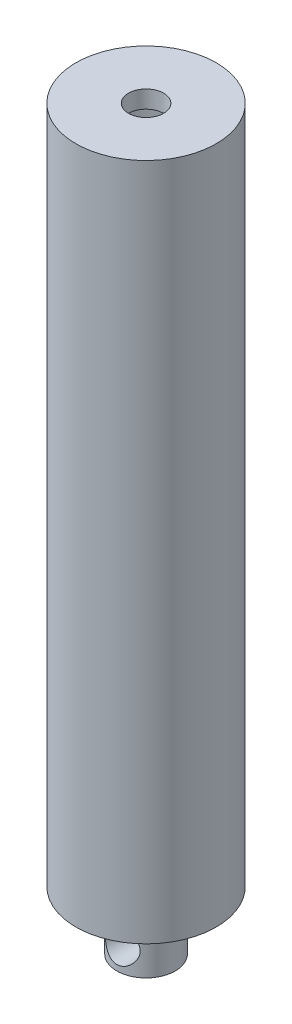
from build123d import *

# Parameters (mm, degrees)
CUT_EXTRUDE_1_DEPTH      = 128.137720603
CUT_EXTRUDE_1_DEPTH_BACK = 128.137720603
SKETCH_2_R               = 3


with BuildPart() as part:
    # 草图1 → 旋转1 (revolve)
    with BuildSketch(Plane.XY, mode=Mode.PRIVATE) as revolve_1_sk:
        Polygon((0, 0), (-5, 0), (-5, 10), (-12, 10), (-12, 126), (-3, 126), (-3, 123), (-10, 123), (-10, 13), (0, 13), align=None)
    revolve(revolve_1_sk.sketch.rotate(Axis((0, 0, 0), (0, 1, 0)), 270), axis=Axis((0, 0, 0), (0, 1, 0)))

    # 草图2 → 切除-拉伸1 (cut, two sides: drawn at the far end of the back side and taken through both)
    with BuildSketch(Plane.XY.offset(-CUT_EXTRUDE_1_DEPTH_BACK)):
        with Locations((0, 3.963259356)):
            Circle(SKETCH_2_R)
    extrude(amount=CUT_EXTRUDE_1_DEPTH + CUT_EXTRUDE_1_DEPTH_BACK, mode=Mode.SUBTRACT)


solid = part.part
